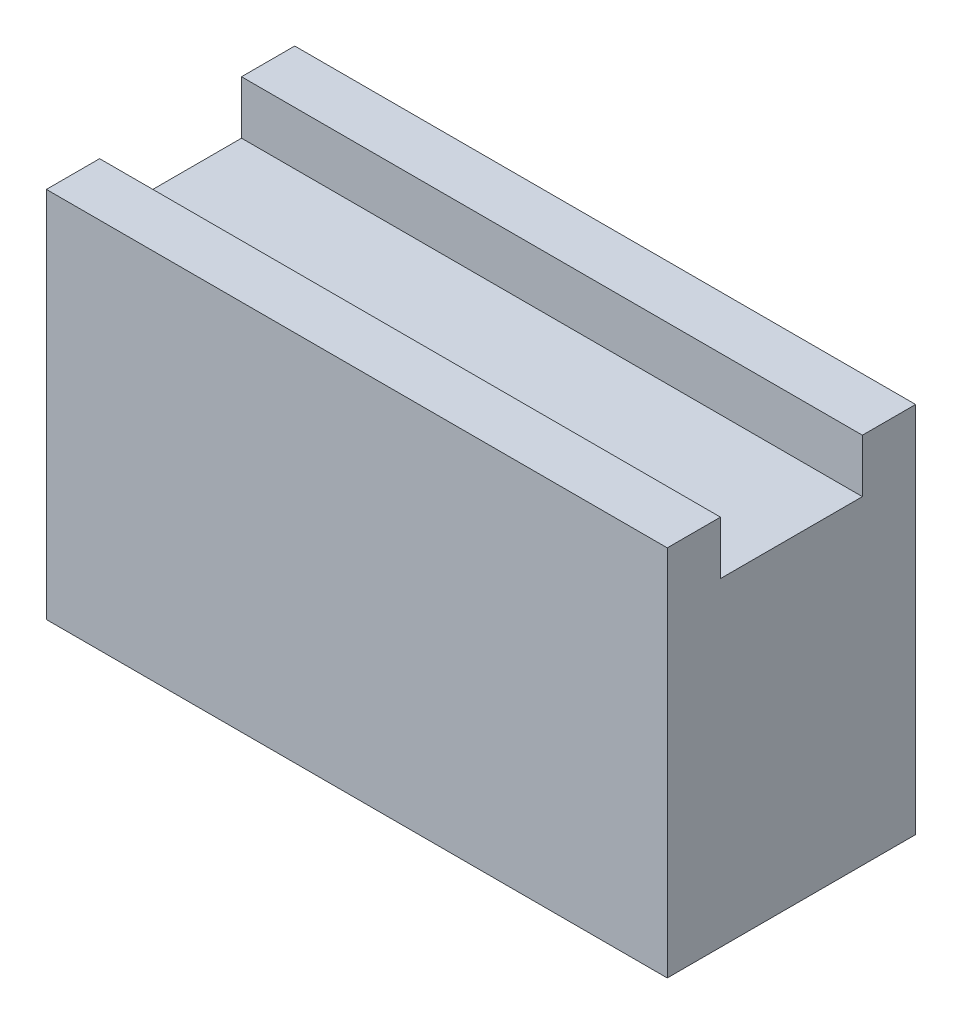
from build123d import *

# Parameters (mm, degrees)
BOSS_EXTRUDE1_DEPTH = 35


with BuildPart() as part:
    # Sketch1 → Boss-Extrude1 (new body)
    with BuildSketch(Plane(origin=(0, 0, 0), x_dir=(0, 0, -1), z_dir=(1, 0, 0))):
        Polygon((-7, 9), (-7, 12), (-4, 12), (-4, 9), (4, 9), (4, 12), (7, 12), (7, 9), (7, -9), (-7, -9), align=None)
    extrude(amount=-BOSS_EXTRUDE1_DEPTH)


solid = part.part
